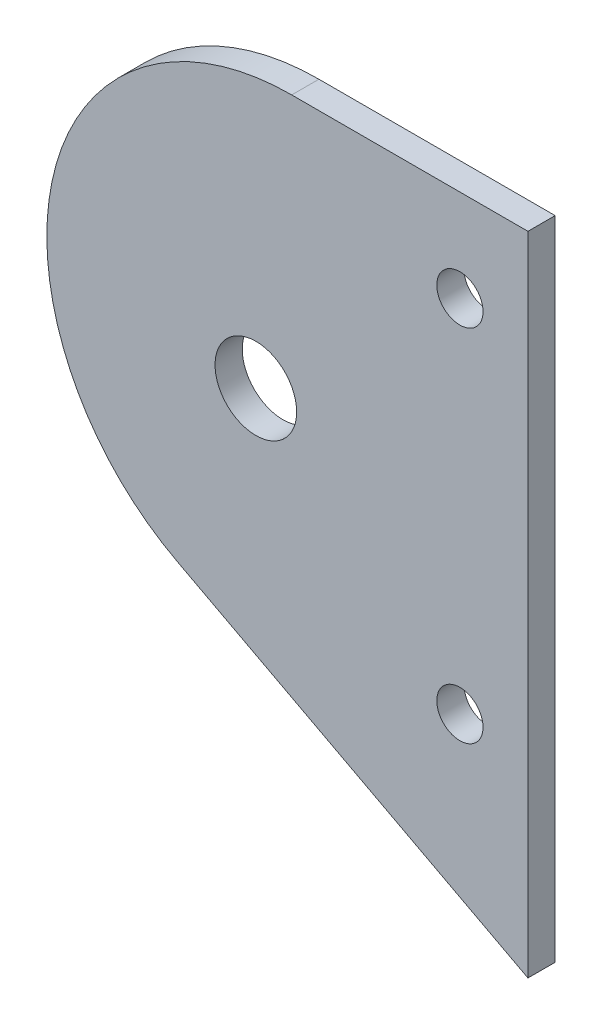
from build123d import *

# Parameters (mm, degrees)
ESQUISSE1_R                  = 3
BOSS_EXTRU_1_DEPTH           = 2
CONG_1_R                     = 18
CONG_2_R                     = 20
ENL_V_MAT_EXTRU_2_DEPTH      = 195.530962239
ENL_V_MAT_EXTRU_2_DEPTH_BACK = 10
ESQUISSE2_W                  = 356.718168982
ESQUISSE2_H                  = 96.805953854
D_GAGEMENT_M31_D             = 3.4


with BuildPart() as part:
    # Esquisse1 → Boss.-Extru.1 (new body)
    with BuildSketch(Plane.XY):
        Polygon((-244.958991582, 40), (-110, 40), (110, 40), (244.958991582, 40), (112.479495791, -30), (-112.479495791, -30), align=None)
        with Locations((-175, 20)):
            Circle(ESQUISSE1_R, mode=Mode.SUBTRACT)
        with Locations((-110, -20)):
            Circle(ESQUISSE1_R, mode=Mode.SUBTRACT)
        with Locations((110, -20)):
            Circle(ESQUISSE1_R, mode=Mode.SUBTRACT)
        with Locations((175, 20)):
            Circle(ESQUISSE1_R, mode=Mode.SUBTRACT)
        with Locations((0, -20)):
            Circle(ESQUISSE1_R, mode=Mode.SUBTRACT)
        with Locations((-58.333333333, 20)):
            Circle(ESQUISSE1_R, mode=Mode.SUBTRACT)
        with Locations((58.333333333, 20)):
            Circle(ESQUISSE1_R, mode=Mode.SUBTRACT)
    extrude(amount=BOSS_EXTRU_1_DEPTH)

    # Congé1
    cong_1_edges = [part.edges().sort_by_distance(p)[0] for p in [
        (-244.958991582, 40, 1),
        (244.958991582, 40, 1),
    ]]
    fillet(cong_1_edges, radius=CONG_1_R)

    # Congé2
    cong_2_edges = [part.edges().sort_by_distance(p)[0] for p in [
        (112.479495791, -30, 1),
        (-112.479495791, -30, 1),
    ]]
    fillet(cong_2_edges, radius=CONG_2_R)

    # Esquisse2 → Enlèv. mat.-Extru.2 (cut, two sides: drawn at the far end of the back side and taken through both)
    with BuildSketch(Plane.XY.offset(-ENL_V_MAT_EXTRU_2_DEPTH_BACK)):
        with Locations((23.359084491, 12.745190259)):
            Rectangle(ESQUISSE2_W, ESQUISSE2_H)
    extrude(amount=ENL_V_MAT_EXTRU_2_DEPTH + ENL_V_MAT_EXTRU_2_DEPTH_BACK, mode=Mode.SUBTRACT)

    # Dégagement M31 (through all)
    with Locations(Plane(origin=(0, 0, 0), x_dir=(-1, 0, 0), z_dir=(0, 0, -1))):
        with Locations((160, 33.228756555), (160, 6.771243445)):
            Hole(D_GAGEMENT_M31_D / 2)


solid = part.part
